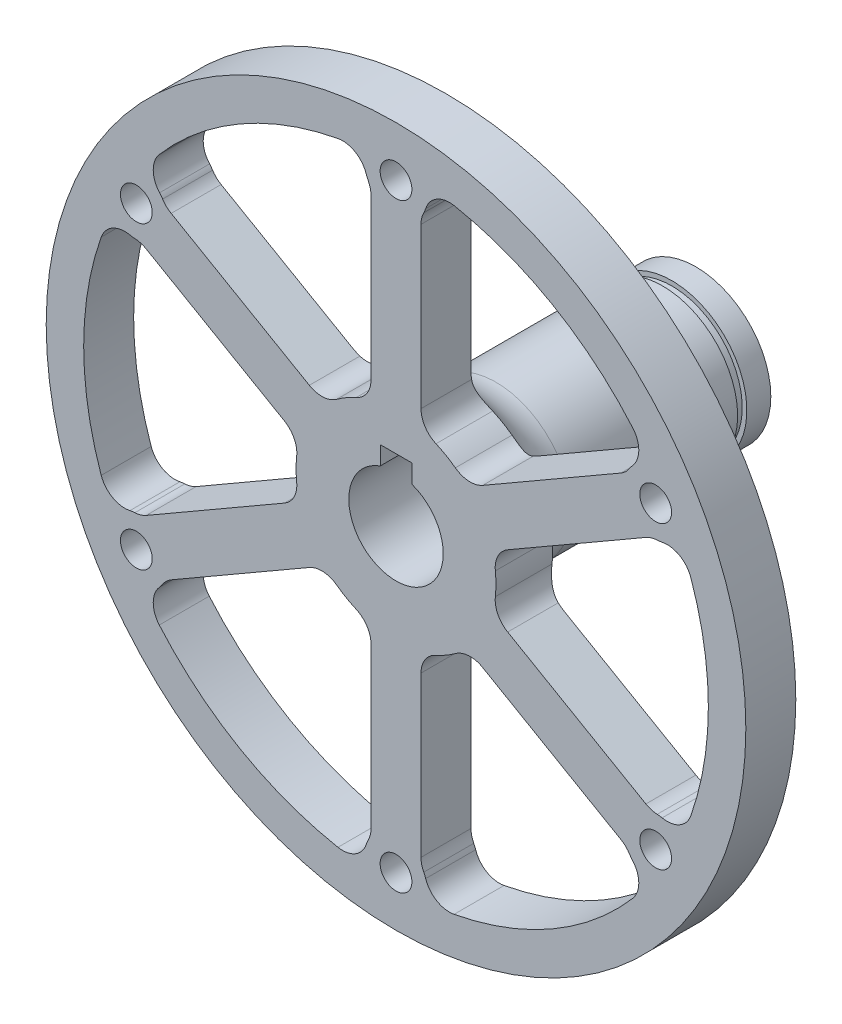
from build123d import *

# Parameters (mm, degrees)
SKETCH1_R              = 9.525
BOSS_EXTRUDE1_DEPTH    = 31.75
SKETCH2_R              = 44.45
BOSS_EXTRUDE2_DEPTH    = 6.35
FILLET1_R              = 6.35
F_10_32_TAPPED_HOLE1_D = 4.0386
CUT_EXTRUDE2_DEPTH     = 74.506564333
CUT_EXTRUDE3_DEPTH     = 74.506564385
SKETCH7_W              = 1.5875
SKETCH7_H              = 1.1684


with BuildPart() as part:
    # Sketch1 → Boss-Extrude1 (new body)
    with BuildSketch(Plane.XY):
        Circle(SKETCH1_R)
    extrude(amount=BOSS_EXTRUDE1_DEPTH)

    # Sketch2 → Boss-Extrude2 (add)
    with BuildSketch(Plane.XY.offset(31.75)):
        Circle(SKETCH2_R)
    extrude(amount=BOSS_EXTRUDE2_DEPTH)

    # Fillet1
    fillet1_edges = [part.edges().sort_by_distance(p)[0] for p in [
        (-9.525, 0, 31.75),
    ]]
    fillet(fillet1_edges, radius=FILLET1_R)

    # #10-32 Tapped Hole1 (through all)
    with Locations(Plane.XY.offset(38.1)):
        with Locations((0, 38.1), (32.995567884, 19.05), (32.995567884, -19.05), (0, -38.1), (-32.995567884, -19.05), (-32.995567884, 19.05)):
            Hole(F_10_32_TAPPED_HOLE1_D / 2)

    # Sketch5 → Cut-Extrude2 (cut, through all)
    with BuildSketch(Plane.XY.offset(38.1)):
        with BuildLine():
            ThreePointArc((3.527777778, 36.28182495), (3.661240112, 36.568237158), (3.771494146, 36.864359086))
            ThreePointArc((3.771494146, 36.864359086), (5.173804158, 38.609483209), (7.379010286, 38.995485168))
            ThreePointArc((7.379010286, 38.995485168), (19.84375, 34.370383213), (30.081575645, 25.888152946))
            ThreePointArc((30.081575645, 25.888152946), (30.849891207, 23.78538744), (30.039724389, 21.698389283))
            ThreePointArc((30.039724389, 21.698389283), (29.838402295, 21.454845526), (29.657093213, 21.196057649))
            ThreePointArc((29.657093213, 21.196057649), (29.177180327, 20.614920426), (28.573813477, 20.163273112))
            Line((28.573813477, 20.163273112), (11.012890619, 10.024469573))
            ThreePointArc((11.012890619, 10.024469573), (9.247553675, 9.604084611), (7.540312495, 10.219280184))
            ThreePointArc((7.540312495, 10.219280184), (6.35, 10.998522628), (5.08, 11.639742265))
            ThreePointArc((5.08, 11.639742265), (3.693604416, 12.810658711), (3.175, 14.549677831))
            Line((3.175, 14.549677831), (3.175, 34.82728491))
            ThreePointArc((3.175, 34.82728491), (3.264454622, 35.575639586), (3.527777778, 36.28182495))
        make_face()
        with BuildLine():
            ThreePointArc((-29.657093213, 21.196057649), (-29.838402295, 21.454845526), (-30.039724389, 21.698389283))
            ThreePointArc((-30.039724389, 21.698389283), (-30.849891207, 23.78538744), (-30.081575645, 25.888152946))
            ThreePointArc((-30.081575645, 25.888152946), (-19.84375, 34.370383213), (-7.379010286, 38.995485168))
            ThreePointArc((-7.379010286, 38.995485168), (-5.173804158, 38.609483209), (-3.771494146, 36.864359086))
            ThreePointArc((-3.771494146, 36.864359086), (-3.661240112, 36.568237158), (-3.527777778, 36.28182495))
            ThreePointArc((-3.527777778, 36.28182495), (-3.264454622, 35.575639586), (-3.175, 34.82728491))
            Line((-3.175, 34.82728491), (-3.175, 14.549677831))
            ThreePointArc((-3.175, 14.549677831), (-3.693604416, 12.810658711), (-5.08, 11.639742265))
            ThreePointArc((-5.08, 11.639742265), (-6.35, 10.998522628), (-7.540312495, 10.219280184))
            ThreePointArc((-7.540312495, 10.219280184), (-9.247553675, 9.604084611), (-11.012890619, 10.024469573))
            Line((-11.012890619, 10.024469573), (-28.573813477, 20.163273112))
            ThreePointArc((-28.573813477, 20.163273112), (-29.177180327, 20.614920426), (-29.657093213, 21.196057649))
        make_face()
        with BuildLine():
            ThreePointArc((-33.184870991, -15.0857673), (-33.499642407, -15.113391633), (-33.811218535, -15.165969802))
            ThreePointArc((-33.811218535, -15.165969802), (-36.023695365, -14.824095769), (-37.460585931, -13.107332222))
            ThreePointArc((-37.460585931, -13.107332222), (-39.6875, 0), (-37.460585931, 13.107332222))
            ThreePointArc((-37.460585931, 13.107332222), (-36.023695365, 14.824095769), (-33.811218535, 15.165969802))
            ThreePointArc((-33.811218535, 15.165969802), (-33.499642407, 15.113391633), (-33.184870991, 15.0857673))
            ThreePointArc((-33.184870991, 15.0857673), (-32.441634949, 14.960719161), (-31.748813477, 14.664011798))
            Line((-31.748813477, 14.664011798), (-14.187890619, 4.525208259))
            ThreePointArc((-14.187890619, 4.525208259), (-12.941158091, 3.2065741), (-12.620312495, 1.420462081))
            ThreePointArc((-12.620312495, 1.420462081), (-12.7, 0), (-12.620312495, -1.420462081))
            ThreePointArc((-12.620312495, -1.420462081), (-12.941158091, -3.2065741), (-14.187890619, -4.525208259))
            Line((-14.187890619, -4.525208259), (-31.748813477, -14.664011798))
            ThreePointArc((-31.748813477, -14.664011798), (-32.441634949, -14.960719161), (-33.184870991, -15.0857673))
        make_face()
        with BuildLine():
            ThreePointArc((-3.527777778, -36.28182495), (-3.661240112, -36.568237158), (-3.771494146, -36.864359086))
            ThreePointArc((-3.771494146, -36.864359086), (-5.173804158, -38.609483209), (-7.379010286, -38.995485168))
            ThreePointArc((-7.379010286, -38.995485168), (-19.84375, -34.370383213), (-30.081575645, -25.888152946))
            ThreePointArc((-30.081575645, -25.888152946), (-30.849891207, -23.78538744), (-30.039724389, -21.698389283))
            ThreePointArc((-30.039724389, -21.698389283), (-29.838402295, -21.454845526), (-29.657093213, -21.196057649))
            ThreePointArc((-29.657093213, -21.196057649), (-29.177180327, -20.614920426), (-28.573813477, -20.163273112))
            Line((-28.573813477, -20.163273112), (-11.012890619, -10.024469573))
            ThreePointArc((-11.012890619, -10.024469573), (-9.247553675, -9.604084611), (-7.540312495, -10.219280184))
            ThreePointArc((-7.540312495, -10.219280184), (-6.35, -10.998522628), (-5.08, -11.639742265))
            ThreePointArc((-5.08, -11.639742265), (-3.693604416, -12.810658711), (-3.175, -14.549677831))
            Line((-3.175, -14.549677831), (-3.175, -34.82728491))
            ThreePointArc((-3.175, -34.82728491), (-3.264454622, -35.575639586), (-3.527777778, -36.28182495))
        make_face()
        with BuildLine():
            ThreePointArc((29.657093213, -21.196057649), (29.838402295, -21.454845526), (30.039724389, -21.698389283))
            ThreePointArc((30.039724389, -21.698389283), (30.849891207, -23.78538744), (30.081575645, -25.888152946))
            ThreePointArc((30.081575645, -25.888152946), (19.84375, -34.370383213), (7.379010286, -38.995485168))
            ThreePointArc((7.379010286, -38.995485168), (5.173804158, -38.609483209), (3.771494146, -36.864359086))
            ThreePointArc((3.771494146, -36.864359086), (3.661240112, -36.568237158), (3.527777778, -36.28182495))
            ThreePointArc((3.527777778, -36.28182495), (3.264454622, -35.575639586), (3.175, -34.82728491))
            Line((3.175, -34.82728491), (3.175, -14.549677831))
            ThreePointArc((3.175, -14.549677831), (3.693604416, -12.810658711), (5.08, -11.639742265))
            ThreePointArc((5.08, -11.639742265), (6.35, -10.998522628), (7.540312495, -10.219280184))
            ThreePointArc((7.540312495, -10.219280184), (9.247553675, -9.604084611), (11.012890619, -10.024469573))
            Line((11.012890619, -10.024469573), (28.573813477, -20.163273112))
            ThreePointArc((28.573813477, -20.163273112), (29.177180327, -20.614920426), (29.657093213, -21.196057649))
        make_face()
        with BuildLine():
            ThreePointArc((33.184870991, 15.0857673), (33.499642407, 15.113391633), (33.811218535, 15.165969802))
            ThreePointArc((33.811218535, 15.165969802), (36.023695365, 14.824095769), (37.460585931, 13.107332222))
            ThreePointArc((37.460585931, 13.107332222), (39.6875, 0), (37.460585931, -13.107332222))
            ThreePointArc((37.460585931, -13.107332222), (36.023695365, -14.824095769), (33.811218535, -15.165969802))
            ThreePointArc((33.811218535, -15.165969802), (33.499642407, -15.113391633), (33.184870991, -15.0857673))
            ThreePointArc((33.184870991, -15.0857673), (32.441634949, -14.960719161), (31.748813477, -14.664011798))
            Line((31.748813477, -14.664011798), (14.187890619, -4.525208259))
            ThreePointArc((14.187890619, -4.525208259), (12.941158091, -3.2065741), (12.620312495, -1.420462081))
            ThreePointArc((12.620312495, -1.420462081), (12.7, 0), (12.620312495, 1.420462081))
            ThreePointArc((12.620312495, 1.420462081), (12.941158091, 3.2065741), (14.187890619, 4.525208259))
            Line((14.187890619, 4.525208259), (31.748813477, 14.664011798))
            ThreePointArc((31.748813477, 14.664011798), (32.441634949, 14.960719161), (33.184870991, 15.0857673))
        make_face()
    extrude(amount=-CUT_EXTRUDE2_DEPTH, mode=Mode.SUBTRACT)

    # Sketch6 → Cut-Extrude3 (cut, through all)
    with BuildSketch(Plane(origin=(0, 0, 0), x_dir=(-1, 0, 0), z_dir=(0, 0, -1))):
        with BuildLine():
            Line((-2, 8), (-2, 5.656854249))
            ThreePointArc((-2, 5.656854249), (0, -6), (2, 5.656854249))
            Line((2, 5.656854249), (2, 8))
            Line((2, 8), (-2, 8))
        make_face()
    extrude(amount=-CUT_EXTRUDE3_DEPTH, mode=Mode.SUBTRACT)

    # Sketch7 → Cut-Revolve1 (revolve, cut)
    with BuildSketch(Plane(origin=(0, 0, 0), x_dir=(1, 0, 0), z_dir=(0, 1, 0))):
        with Locations((-9.73455, -3.6322)):
            Rectangle(SKETCH7_W, SKETCH7_H)
    revolve(axis=Axis((0, 0, 0), (0, 0, 1)), mode=Mode.SUBTRACT)


solid = part.part
